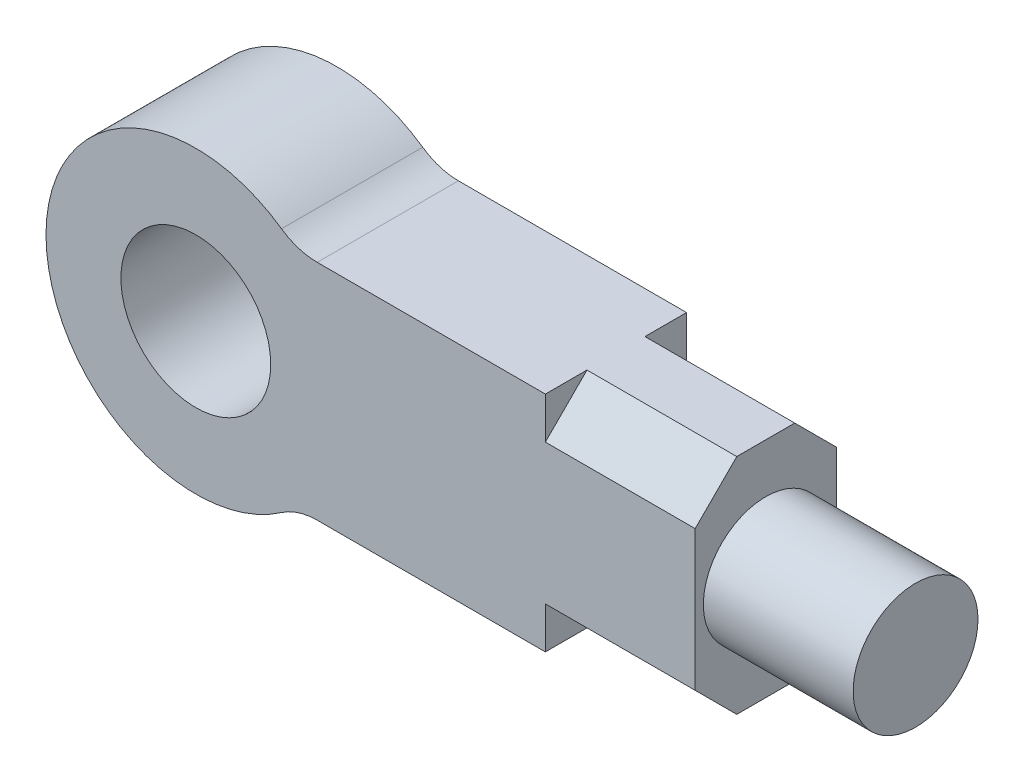
from build123d import *

# Parameters (mm, degrees)
SKETCH1_R           = 6
BOSS_EXTRUDE1_DEPTH = 5.655
BOSS_EXTRUDE2_DEPTH = 12
SKETCH3_R           = 5
BOSS_EXTRUDE3_DEPTH = 12


with BuildPart() as part:
    # Sketch1 → Boss-Extrude1 (new, symmetric)
    with BuildSketch(Plane.XY):
        with BuildLine():
            Line((9.724056813, 8.94427191), (28, 8.94427191))
            Line((28, 8.94427191), (28, -8.94427191))
            Line((28, -8.94427191), (9.724056813, -8.94427191))
            ThreePointArc((9.724056813, -8.94427191), (8.225104215, -9.174246636), (6.864040103, -9.843015466))
            ThreePointArc((6.864040103, -9.843015466), (-12, 0), (6.864040103, 9.843015466))
            ThreePointArc((6.864040103, 9.843015466), (8.225104215, 9.174246636), (9.724056813, 8.94427191))
        make_face()
        Circle(SKETCH1_R, mode=Mode.SUBTRACT)
    extrude(amount=BOSS_EXTRUDE1_DEPTH, both=True)

    # Sketch2 → Boss-Extrude2 (add)
    with BuildSketch(Plane(origin=(28, 0, 0), x_dir=(0, 0, -1), z_dir=(1, 0, 0))):
        Polygon((2.321666667, 8.94427191), (-2.321666667, 8.94427191), (-5.655, 5.610938577), (-5.655, -5.610938577), (-2.321666667, -8.94427191), (2.321666667, -8.94427191), (5.655, -5.610938577), (5.655, 5.610938577), align=None)
    extrude(amount=BOSS_EXTRUDE2_DEPTH)

    # Sketch3 → Boss-Extrude3 (add)
    with BuildSketch(Plane(origin=(40, 0, 0), x_dir=(0, 0, -1), z_dir=(1, 0, 0))):
        Circle(SKETCH3_R)
    extrude(amount=BOSS_EXTRUDE3_DEPTH)


solid = part.part
